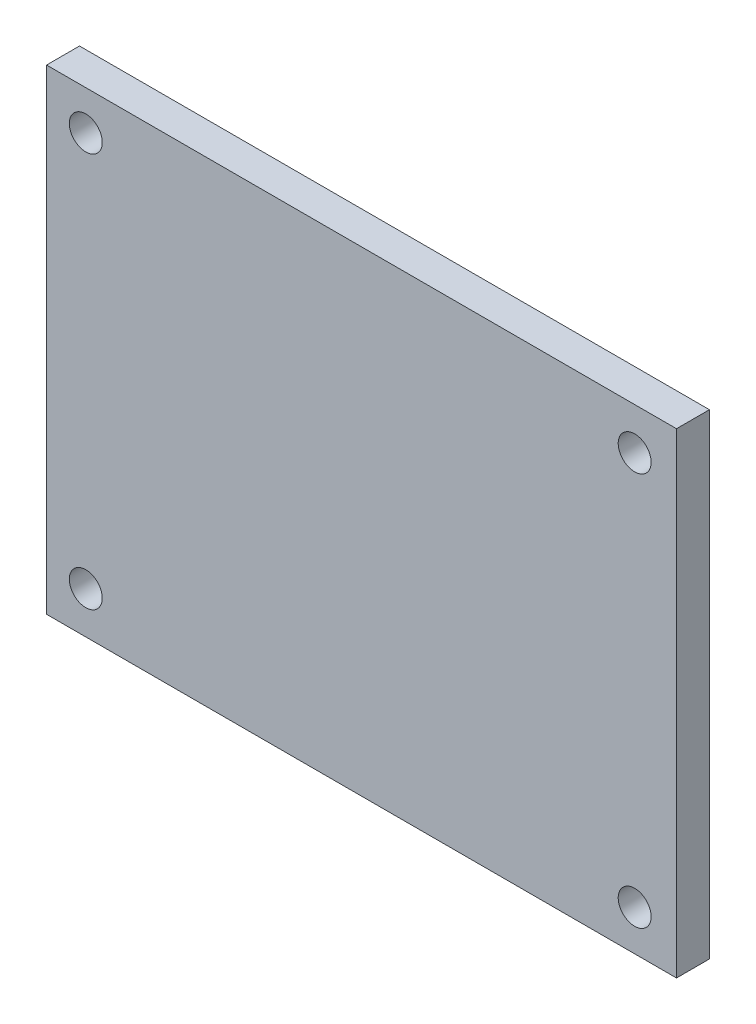
from build123d import *

# Parameters (mm, degrees)
ESQUISSE1_W             = 61.214
ESQUISSE1_H             = 46.228
BOSS_EXTRU_1_DEPTH      = 3.2
ESQUISSE2_R             = 1.6
ENL_V_MAT_EXTRU_1_DEPTH = 3.2


with BuildPart() as part:
    # Esquisse1 → Boss.-Extru.1 (new body)
    with BuildSketch(Plane.XY):
        with Locations((30.607, 23.114)):
            Rectangle(ESQUISSE1_W, ESQUISSE1_H)
    extrude(amount=BOSS_EXTRU_1_DEPTH)

    # Esquisse2 → Enlèv. mat.-Extru.1 (cut)
    with BuildSketch(Plane.XY.offset(3.2)):
        with Locations((3.81, 4.064)):
            Circle(ESQUISSE2_R)
        with Locations((3.81, 42.418)):
            Circle(ESQUISSE2_R)
        with Locations((57.15, 42.164)):
            Circle(ESQUISSE2_R)
        with Locations((57.15, 3.92)):
            Circle(ESQUISSE2_R)
    extrude(amount=-ENL_V_MAT_EXTRU_1_DEPTH, mode=Mode.SUBTRACT)


solid = part.part
